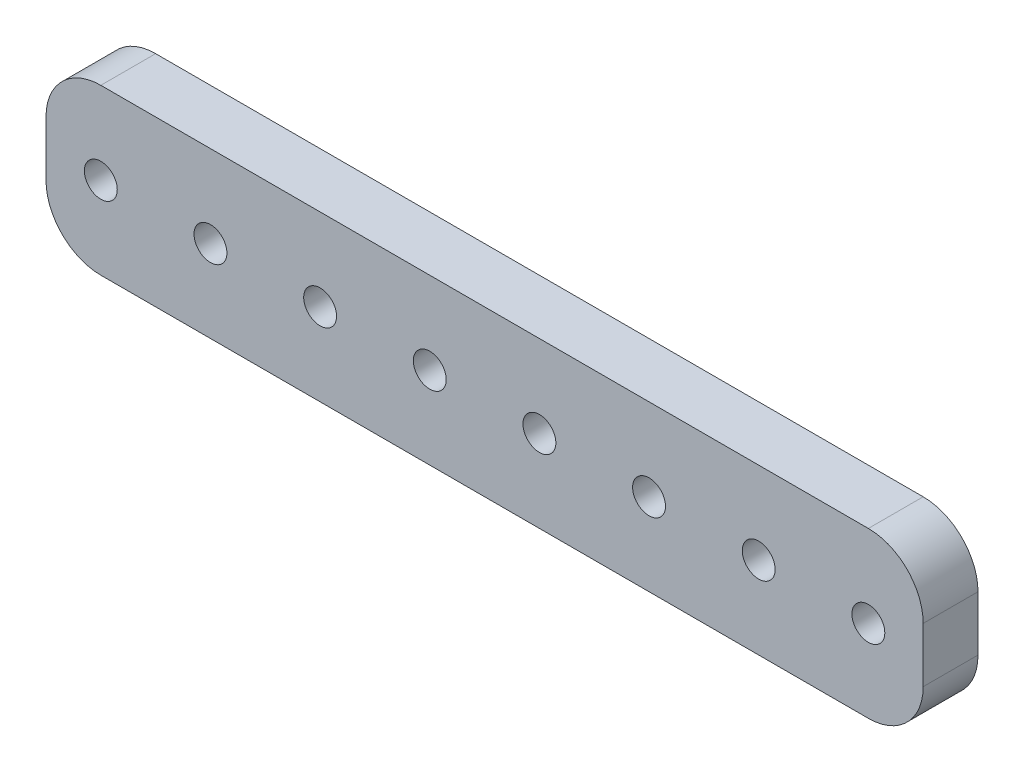
from build123d import *

# Parameters (mm, degrees)
SKETCH1_W           = 160
SKETCH1_H           = 30
BOSS_EXTRUDE1_DEPTH = 10
SKETCH2_R           = 3
CUT_EXTRUDE1_DEPTH  = 9.8
FILLET2_R           = 10


with BuildPart() as part:
    # Sketch1 → Boss-Extrude1 (new body)
    with BuildSketch(Plane.XY):
        Rectangle(SKETCH1_W, SKETCH1_H)
    extrude(amount=BOSS_EXTRUDE1_DEPTH)

    # Sketch2 → Cut-Extrude1 (cut)
    with BuildSketch(Plane.XY.offset(10)):
        with Locations((30, 0)):
            Circle(SKETCH2_R)
        with Locations((-30, 0)):
            Circle(SKETCH2_R)
        with Locations((-70, 0)):
            Circle(SKETCH2_R)
        with Locations((-50, 0)):
            Circle(SKETCH2_R)
        with Locations((50, 0)):
            Circle(SKETCH2_R)
        with Locations((70, 0)):
            Circle(SKETCH2_R)
        with Locations((-10, 0)):
            Circle(SKETCH2_R)
        with Locations((10, 0)):
            Circle(SKETCH2_R)
    extrude(amount=-CUT_EXTRUDE1_DEPTH, mode=Mode.SUBTRACT)

    # Fillet2
    fillet2_edges = [part.edges().sort_by_distance(p)[0] for p in [
        (80, -15, 5),
        (-80, -15, 5),
        (-80, 15, 5),
        (80, 15, 5),
    ]]
    fillet(fillet2_edges, radius=FILLET2_R)


solid = part.part
